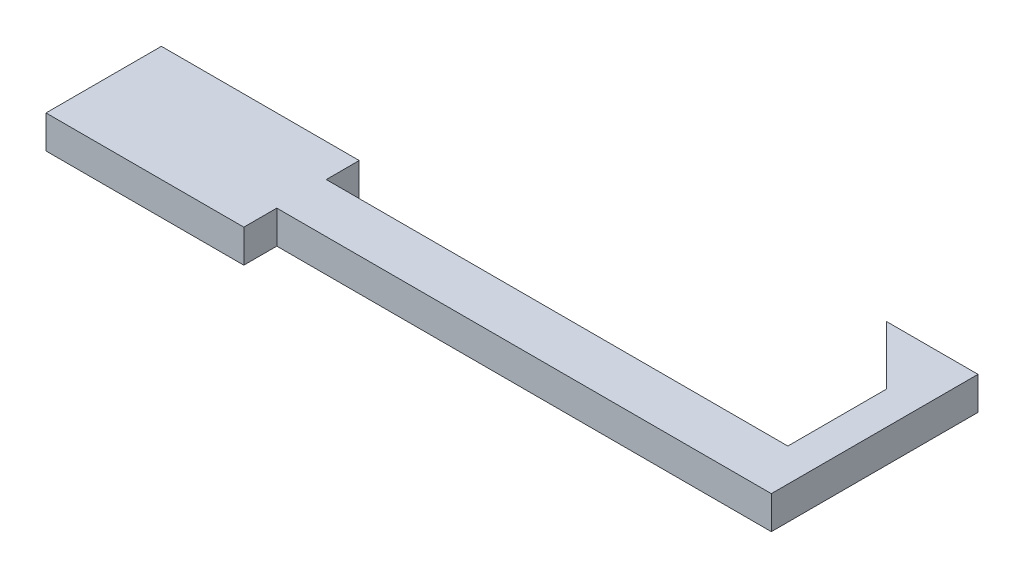
from build123d import *

# Parameters (mm, degrees)
BOSS_EXTRUDE1_DEPTH = 0.5


with BuildPart() as part:
    # Sketch1 → Boss-Extrude1 (new body)
    with BuildSketch(Plane(origin=(0, 0, 0), x_dir=(1, 0, 0), z_dir=(0, 1, 0))):
        Polygon((-30.973296771, 20.942182778), (-30.973296771, 22.692182778), (-27.973296771, 22.692182778), (-27.973296771, 22.192182778), (-27.973296771, 21.442182778), (-27.973296771, 20.942182778), align=None)
        Polygon((-27.973296771, 22.192182778), (-27.973296771, 21.442182778), (-20.473296771, 21.442182778), (-20.473296771, 24.576066254), (-21.857180247, 24.576066254), (-20.973296771, 23.692182778), (-20.973296771, 22.192182778), align=None)
    extrude(amount=BOSS_EXTRUDE1_DEPTH)


solid = part.part
